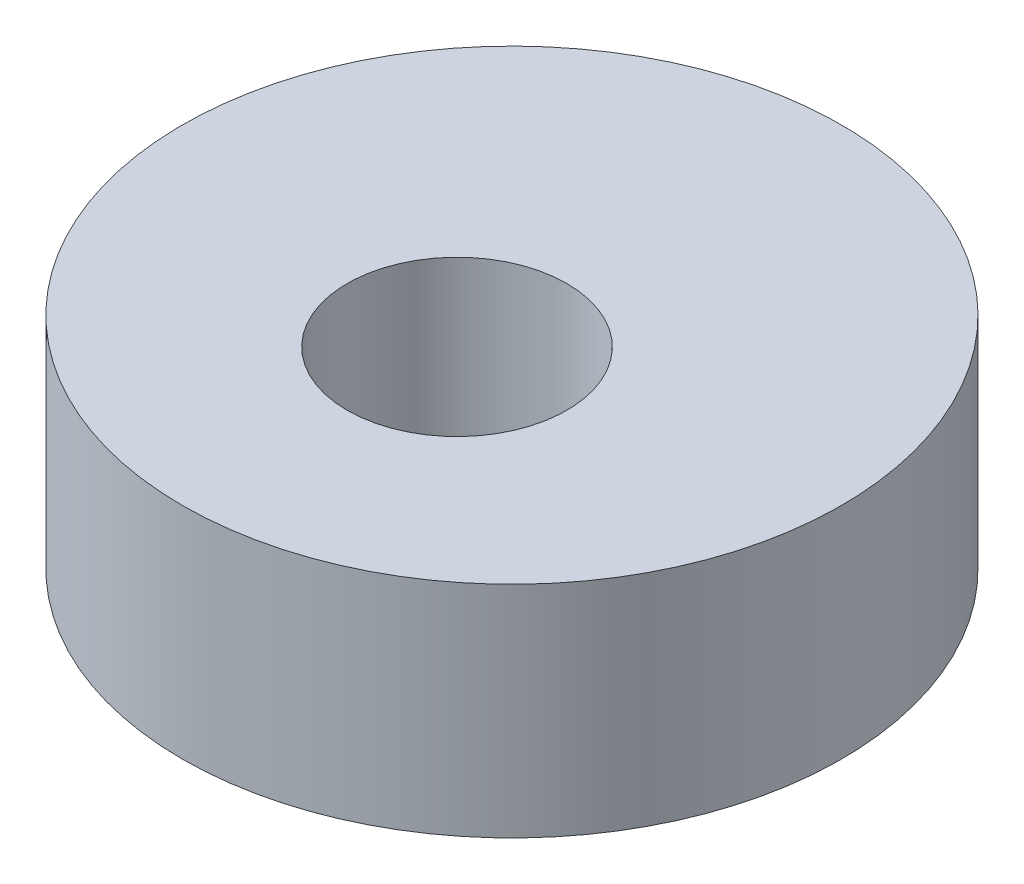
from build123d import *

# Parameters (mm, degrees)
SKETCH1_R           = 9.525
SKETCH1_R_2         = 3.175
BOSS_EXTRUDE1_DEPTH = 6.35


with BuildPart() as part:
    # Sketch1 → Boss-Extrude1 (new body)
    with BuildSketch(Plane(origin=(0, 0, 0), x_dir=(1, 0, 0), z_dir=(0, 1, 0))):
        with Locations(Location((0, 0, 0), (0, 0, 270))):
            Circle(SKETCH1_R)
        with Locations(Location((0, -1.5875, 0), (0, 0, 270))):
            Circle(SKETCH1_R_2, mode=Mode.SUBTRACT)
    extrude(amount=BOSS_EXTRUDE1_DEPTH)


solid = part.part
